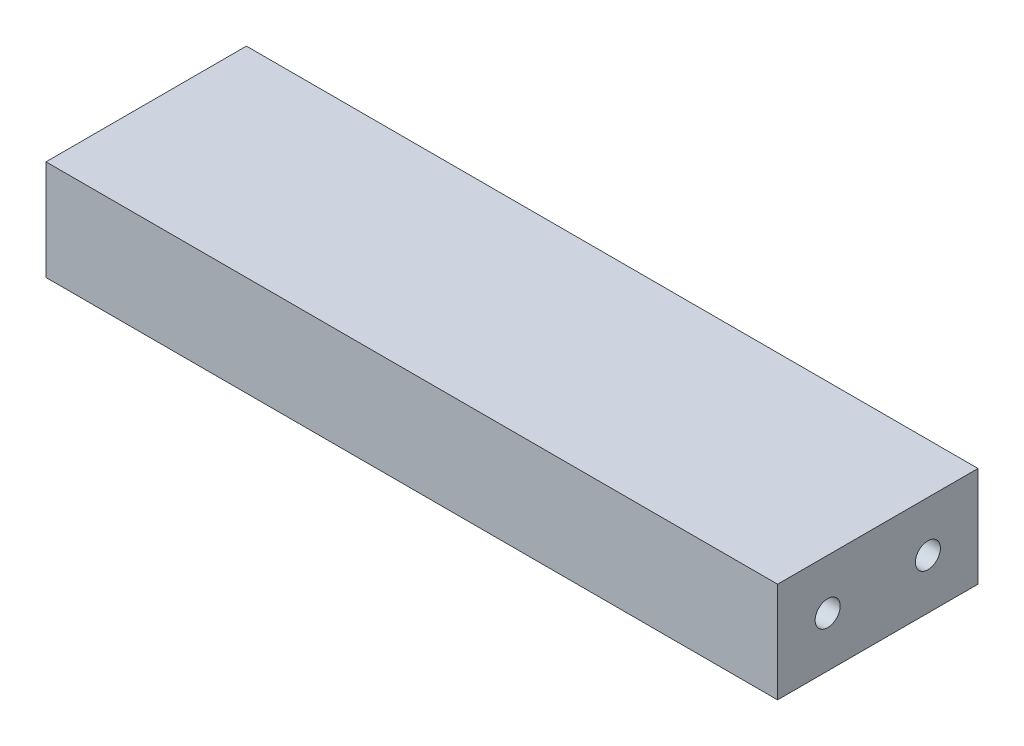
from build123d import *

# Parameters (mm, degrees)
SKETCH_1_W          = 73
SKETCH_1_H          = 20
EXTRUDE_1_DEPTH     = 10
SKETCH_2_R          = 1.25
CUT_EXTRUDE_1_DEPTH = 20


with BuildPart() as part:
    # 草图1 → 凸台-拉伸1 (new body)
    with BuildSketch(Plane(origin=(0, 0, 0), x_dir=(1, 0, 0), z_dir=(0, 1, 0))):
        Rectangle(SKETCH_1_W, SKETCH_1_H)
    extrude(amount=EXTRUDE_1_DEPTH)

    # 草图2 → 切除-拉伸1 (cut)
    with BuildSketch(Plane(origin=(36.5, 0, 0), x_dir=(0, 0, -1), z_dir=(1, 0, 0))):
        with Locations((-5, 5)):
            Circle(SKETCH_2_R)
        with Locations((5, 5)):
            Circle(SKETCH_2_R)
    cut_extrude_1 = extrude(amount=-CUT_EXTRUDE_1_DEPTH, mode=Mode.SUBTRACT)

    # 镜向1: 切除-拉伸1 across plane
    add(cut_extrude_1.mirror(Plane(origin=(0, 0, 0), x_dir=(0, 0, 1), z_dir=(1, 0, 0))), mode=Mode.SUBTRACT)


solid = part.part
